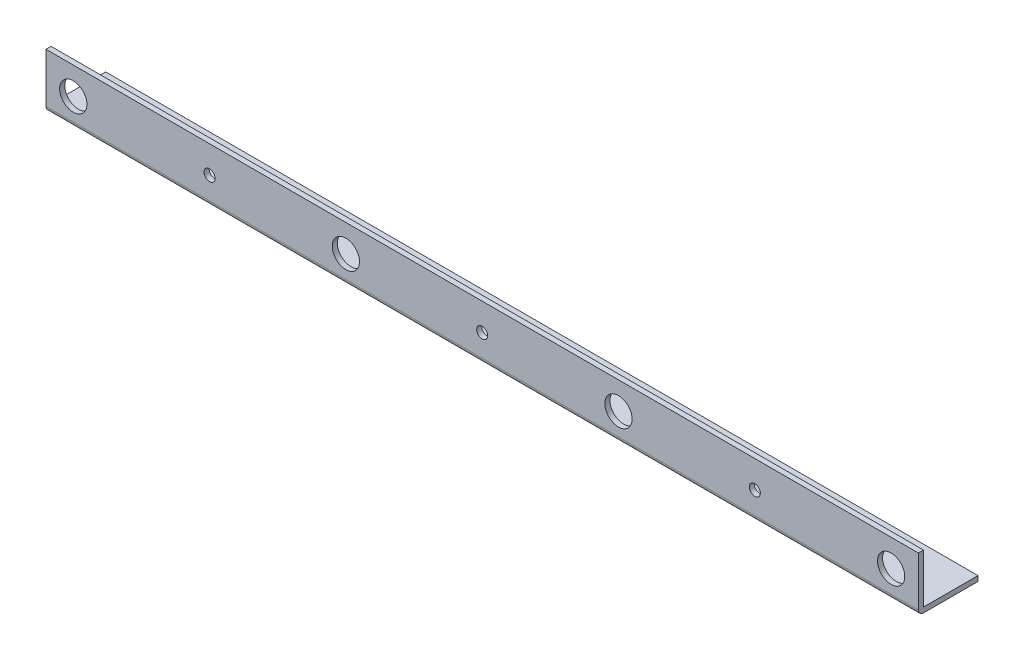
from build123d import *

# Parameters (mm, degrees)
SKETCH1_W           = 406.4
SKETCH1_H           = 25.4
BOSS_EXTRUDE1_DEPTH = 2.38125
SKETCH2_W           = 406.4
SKETCH2_H           = 25.4
SKETCH2_R           = 6.35
SKETCH2_R_2         = 2.5796875
BOSS_EXTRUDE2_DEPTH = 2.38125
FILLET1_R           = 2.38125


with BuildPart() as part:
    # Sketch1 → Boss-Extrude1 (new body)
    with BuildSketch(Plane(origin=(0, 0, 0), x_dir=(1, 0, 0), z_dir=(0, 1, 0))):
        with Locations((203.2, 12.7)):
            Rectangle(SKETCH1_W, SKETCH1_H)
    extrude(amount=BOSS_EXTRUDE1_DEPTH)

    # Sketch2 → Boss-Extrude2 (add)
    with BuildSketch(Plane.XY):
        with Locations((203.2, 12.7)):
            Rectangle(SKETCH2_W, SKETCH2_H)
        with Locations(Location((12.7, 12.7, 0), (0, 0, 180))):
            Circle(SKETCH2_R, mode=Mode.SUBTRACT)
        with Locations(Location((139.7, 12.7, 0), (0, 0, 180))):
            Circle(SKETCH2_R, mode=Mode.SUBTRACT)
        with Locations(Location((266.7, 12.7, 0), (0, 0, 180))):
            Circle(SKETCH2_R, mode=Mode.SUBTRACT)
        with Locations(Location((393.7, 12.7, 0), (0, 0, 180))):
            Circle(SKETCH2_R, mode=Mode.SUBTRACT)
        with Locations(Location((76.2, 12.7, 0), (0, 0, 180))):
            Circle(SKETCH2_R_2, mode=Mode.SUBTRACT)
        with Locations(Location((203.2, 12.7, 0), (0, 0, 180))):
            Circle(SKETCH2_R_2, mode=Mode.SUBTRACT)
        with Locations(Location((330.2, 12.7, 0), (0, 0, 180))):
            Circle(SKETCH2_R_2, mode=Mode.SUBTRACT)
    extrude(amount=BOSS_EXTRUDE2_DEPTH)

    # Fillet1
    fillet1_edges = [part.edges().sort_by_distance(p)[0] for p in [
        (203.2, 0, 2.38125),
    ]]
    fillet(fillet1_edges, radius=FILLET1_R)


solid = part.part
